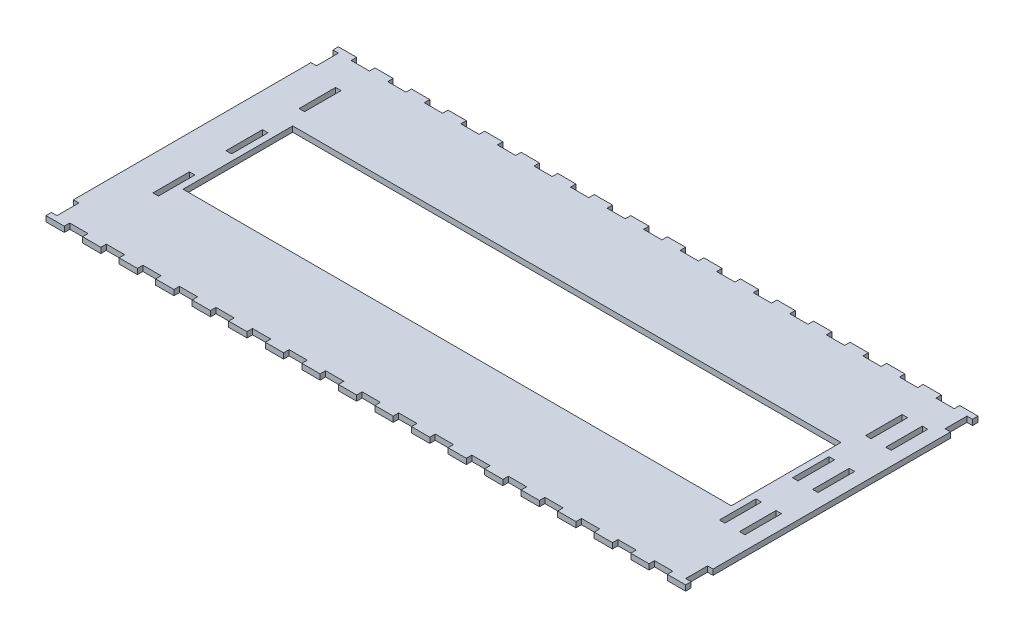
from build123d import *

# Parameters (mm, degrees)
CROQUIS1_W              = 3
CROQUIS1_H              = 20
CROQUIS1_W_2            = 300
CROQUIS1_H_2            = 60
SALIENTE_EXTRUIR1_DEPTH = 3


with BuildPart() as part:
    # Croquis1 → Saliente-Extruir1 (new body)
    with BuildSketch(Plane(origin=(0, 0, 0), x_dir=(1, 0, 0), z_dir=(0, 1, 0))):
        Polygon((155, -80), (162, -80), (165, -80), (165, -77), (162, -77), (162, -65.002891293), (165, -65.002891293), (165, 64.997108707), (162, 64.997108707), (162, 77), (165, 77), (165, 80), (162, 80), (155, 80), (155, 77), (145, 77), (145, 80), (135, 80), (135, 77), (125, 77), (125, 80), (115, 80), (115, 77), (105, 77), (105, 80), (95, 80), (95, 77), (85, 77), (85, 80), (75, 80), (75, 77), (65, 77), (65, 80), (55, 80), (55, 77), (45, 77), (45, 80), (35, 80), (35, 77), (25, 77), (25, 80), (15, 80), (15, 77), (5, 77), (5, 80), (-5, 80), (-5, 77), (-15, 77), (-15, 80), (-25, 80), (-25, 77), (-35, 77), (-35, 80), (-45, 80), (-45, 77), (-55, 77), (-55, 80), (-65, 80), (-65, 77), (-75, 77), (-75, 80), (-85, 80), (-85, 77), (-95, 77), (-95, 80), (-105, 80), (-105, 77), (-115, 77), (-115, 80), (-125, 80), (-125, 77), (-135, 77), (-135, 80), (-145, 80), (-145, 77), (-155, 77), (-155, 80), (-165, 80), (-165, 77), (-175, 77), (-175, 80), (-182, 80), (-185, 80), (-185, 77), (-182, 77), (-182, 64.997108707), (-185, 64.997108707), (-185, -65.002891293), (-182, -65.002891293), (-182, -77), (-185, -77), (-185, -80), (-182, -80), (-175, -80), (-175, -77), (-165, -77), (-165, -80), (-155, -80), (-155, -77), (-145, -77), (-145, -80), (-135, -80), (-135, -77), (-125, -77), (-125, -80), (-115, -80), (-115, -77), (-105, -77), (-105, -80), (-95, -80), (-95, -77), (-85, -77), (-85, -80), (-75, -80), (-75, -77), (-65, -77), (-65, -80), (-55, -80), (-55, -77), (-45, -77), (-45, -80), (-35, -80), (-35, -77), (-25, -77), (-25, -80), (-15, -80), (-15, -77), (-5, -77), (-5, -80), (5, -80), (5, -77), (15, -77), (15, -80), (25, -80), (25, -77), (35, -77), (35, -80), (45, -80), (45, -77), (55, -77), (55, -80), (65, -80), (65, -77), (75, -77), (75, -80), (85, -80), (85, -77), (95, -77), (95, -80), (105, -80), (105, -77), (115, -77), (115, -80), (125, -80), (125, -77), (135, -77), (135, -80), (145, -80), (145, -77), (155, -77), align=None)
        with Locations((-165, -30.002891293)):
            Rectangle(CROQUIS1_W, CROQUIS1_H, mode=Mode.SUBTRACT)
        with Locations((-10, 0)):
            Rectangle(CROQUIS1_W_2, CROQUIS1_H_2, mode=Mode.SUBTRACT)
        with Locations((156, -30.002891293)):
            Rectangle(CROQUIS1_W, CROQUIS1_H, mode=Mode.SUBTRACT)
        with Locations((-165, 49.997108707)):
            Rectangle(CROQUIS1_W, CROQUIS1_H, mode=Mode.SUBTRACT)
        with Locations((-165, 9.997108707)):
            Rectangle(CROQUIS1_W, CROQUIS1_H, mode=Mode.SUBTRACT)
        with Locations((145, 9.997108707)):
            Rectangle(CROQUIS1_W, CROQUIS1_H, mode=Mode.SUBTRACT)
        with Locations((145, -30.002891293)):
            Rectangle(CROQUIS1_W, CROQUIS1_H, mode=Mode.SUBTRACT)
        with Locations((145, 49.997108707)):
            Rectangle(CROQUIS1_W, CROQUIS1_H, mode=Mode.SUBTRACT)
        with Locations((156, 49.997108707)):
            Rectangle(CROQUIS1_W, CROQUIS1_H, mode=Mode.SUBTRACT)
        with Locations((156, 9.997108707)):
            Rectangle(CROQUIS1_W, CROQUIS1_H, mode=Mode.SUBTRACT)
    extrude(amount=SALIENTE_EXTRUIR1_DEPTH)


solid = part.part
